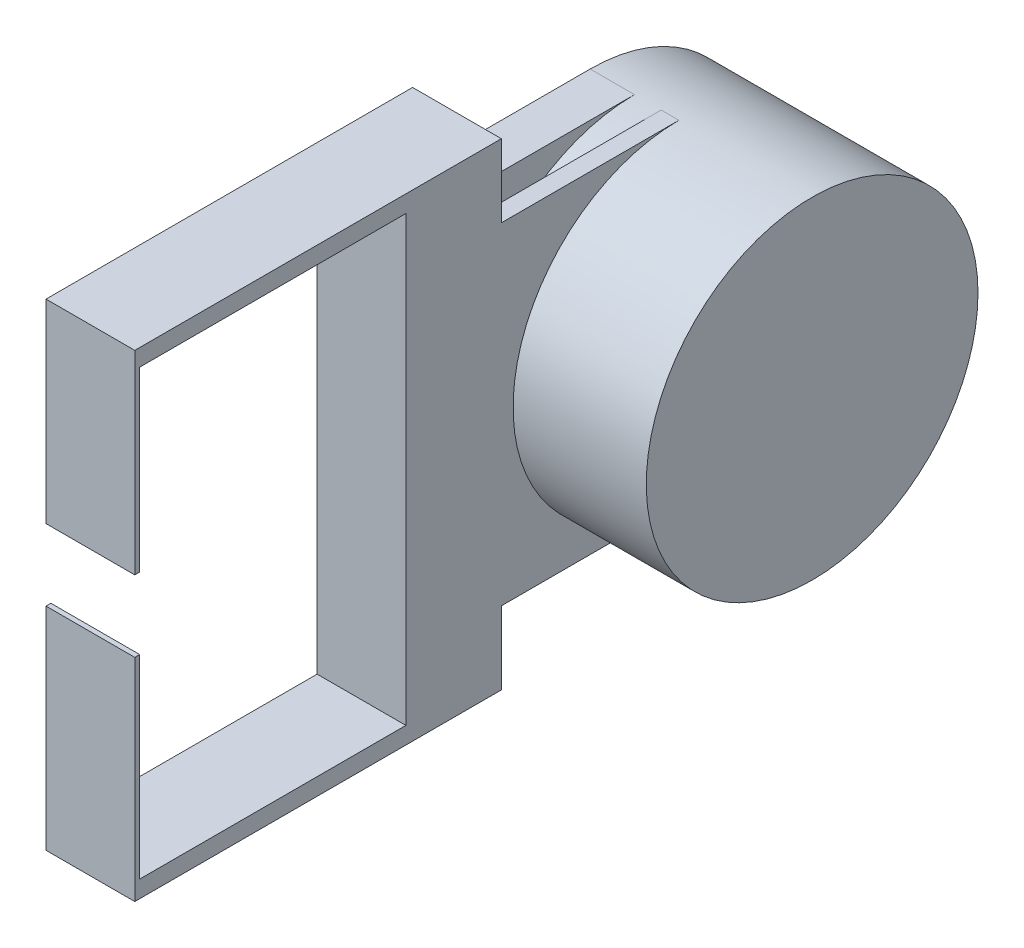
from build123d import *

# Parameters (mm, degrees)
SKETCH1_R                = 23.72487
BOSS_EXTRUDE1_DEPTH      = 31.75
SKETCH2_W                = 47.44974
SKETCH2_H                = 6.35
BOSS_EXTRUDE2_DEPTH      = 25.4
SKETCH3_W                = 12.7
SKETCH3_H                = 68.28282
BOSS_EXTRUDE3_DEPTH      = 13.65758
SKETCH4_W                = 12.7
SKETCH4_H                = 2.43586
BOSS_EXTRUDE4_DEPTH      = 38.0746
SKETCH5_W                = 12.7
SKETCH5_H                = 27.81554
SKETCH5_H_2              = 30.2514
BOSS_EXTRUDE5_DEPTH      = 0.70358
BOSS_EXTRUDE8_REACH      = 72.166
BOSS_EXTRUDE8_END_RADIUS = 23.72487
SKETCH9_W                = 2.54
SKETCH9_H                = 47.44974


with BuildPart() as part:
    # Sketch1 → Boss-Extrude1 (new body)
    with BuildSketch(Plane.YZ):
        with Locations(Location((0, 0, 0), (0, 0, 270))):
            Circle(SKETCH1_R)
    extrude(amount=BOSS_EXTRUDE1_DEPTH)

    # Sketch2 → Boss-Extrude2 (add)
    with BuildSketch(Plane(origin=(0, 0, 0), x_dir=(0, 1, 0), z_dir=(0, 0, 1))):
        with Locations((0, -3.175)):
            Rectangle(SKETCH2_W, SKETCH2_H)
    extrude(amount=BOSS_EXTRUDE2_DEPTH)

    # Sketch3 → Boss-Extrude3 (add)
    with BuildSketch(Plane.XY.offset(25.4)):
        with Locations((6.35, 0)):
            Rectangle(SKETCH3_W, SKETCH3_H)
    extrude(amount=BOSS_EXTRUDE3_DEPTH)

    # Sketch4 → Boss-Extrude4 (add)
    with BuildSketch(Plane.XY.offset(39.05758)):
        with Locations((6.35, 32.92348)):
            Rectangle(SKETCH4_W, SKETCH4_H)
        with Locations((6.35, -32.92348)):
            Rectangle(SKETCH4_W, SKETCH4_H)
    extrude(amount=BOSS_EXTRUDE4_DEPTH)

    # Sketch5 → Boss-Extrude5 (add)
    with BuildSketch(Plane.XY.offset(77.13218)):
        with Locations((6.35, 20.23364)):
            Rectangle(SKETCH5_W, SKETCH5_H)
        with Locations((6.35, -19.01571)):
            Rectangle(SKETCH5_W, SKETCH5_H_2)
    extrude(amount=BOSS_EXTRUDE5_DEPTH)

    # Boss-Extrude8: up to this cylinder (the profile starts outside it)
    boss_extrude8_end = Plane(origin=(11.43, 0, 0), z_dir=(-1, 0, 0)) * Cylinder(BOSS_EXTRUDE8_END_RADIUS, 192.78174, mode=Mode.PRIVATE)
    # Sketch9 → Boss-Extrude8 (add, up to the surface)
    with BuildSketch(Plane(origin=(0, 0, 25.4), x_dir=(1, 0, 0), z_dir=(0, 0, -1)), mode=Mode.PRIVATE) as boss_extrude8_sk1:
        with Locations((11.43, 0)):
            Rectangle(SKETCH9_W, SKETCH9_H)
    boss_extrude8_tool1 = extrude(boss_extrude8_sk1.sketch, amount=BOSS_EXTRUDE8_REACH, mode=Mode.PRIVATE) - boss_extrude8_end
    add(boss_extrude8_tool1.solids().sort_by_distance((11.43, 0, 25.4))[0])


solid = part.part
